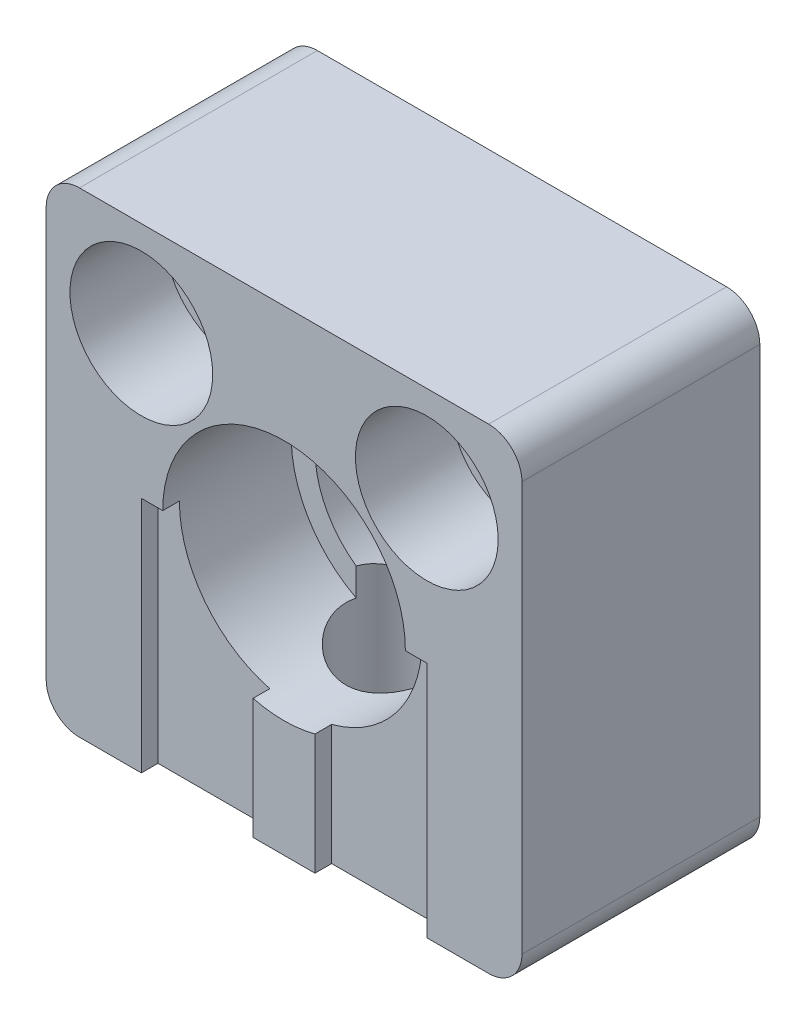
from build123d import *

# Parameters (mm, degrees)
SKETCH1_W           = 10
SKETCH1_H           = 5
BOSS_EXTRUDE1_DEPTH = 10
SKETCH2_R           = 2.05
CUT_EXTRUDE1_DEPTH  = 16
SKETCH3_R           = 2.55
CUT_EXTRUDE2_DEPTH  = 2.7
SKETCH5_W           = 2.35
SKETCH5_H           = 0.35
CUT_EXTRUDE3_DEPTH  = 5
SKETCH6_R           = 1.5
CUT_EXTRUDE4_DEPTH  = 2
SKETCH8_R           = 1.2
CUT_EXTRUDE5_DEPTH  = 3.5
FILLET1_R           = 0.7


with BuildPart() as part:
    # Sketch1 → Boss-Extrude1 (new body)
    with BuildSketch(Plane(origin=(0, 0, 0), x_dir=(1, 0, 0), z_dir=(0, 1, 0))):
        with Locations((5, 2.5)):
            Rectangle(SKETCH1_W, SKETCH1_H)
    extrude(amount=BOSS_EXTRUDE1_DEPTH)

    # Sketch2 → Cut-Extrude1 (cut, through all)
    with BuildSketch(Plane.XY):
        with Locations((5, 5)):
            Circle(SKETCH2_R)
    extrude(amount=-CUT_EXTRUDE1_DEPTH, mode=Mode.SUBTRACT)

    # Sketch3 → Cut-Extrude2 (cut)
    with BuildSketch(Plane.XY):
        with Locations((5, 5)):
            Circle(SKETCH3_R)
    extrude(amount=-CUT_EXTRUDE2_DEPTH, mode=Mode.SUBTRACT)

    # Sketch5 → Cut-Extrude3 (cut)
    with BuildSketch(Plane.XZ):
        with Locations((3.175, -0.175)):
            Rectangle(SKETCH5_W, SKETCH5_H)
        with Locations((6.825, -0.175)):
            Rectangle(SKETCH5_W, SKETCH5_H)
    extrude(amount=-CUT_EXTRUDE3_DEPTH, mode=Mode.SUBTRACT)

    # Sketch6 → Cut-Extrude4 (cut)
    with BuildSketch(Plane.XY):
        with Locations((2, 8)):
            Circle(SKETCH6_R)
        with Locations((8, 8)):
            Circle(SKETCH6_R)
    extrude(amount=-CUT_EXTRUDE4_DEPTH, mode=Mode.SUBTRACT)

    # Sketch8 → Cut-Extrude5 (cut)
    with BuildSketch(Plane.XZ):
        with Locations(Location((5, -2.5, 0), (0, 0, 270))):
            Circle(SKETCH8_R)
    extrude(amount=-CUT_EXTRUDE5_DEPTH, mode=Mode.SUBTRACT)

    # Fillet1
    fillet1_edges = [part.edges().sort_by_distance(p)[0] for p in [
        (10, 10, -2.5),
        (0, 10, -2.5),
        (10, 0, -2.5),
        (0, 0, -2.5),
    ]]
    fillet(fillet1_edges, radius=FILLET1_R)


solid = part.part
